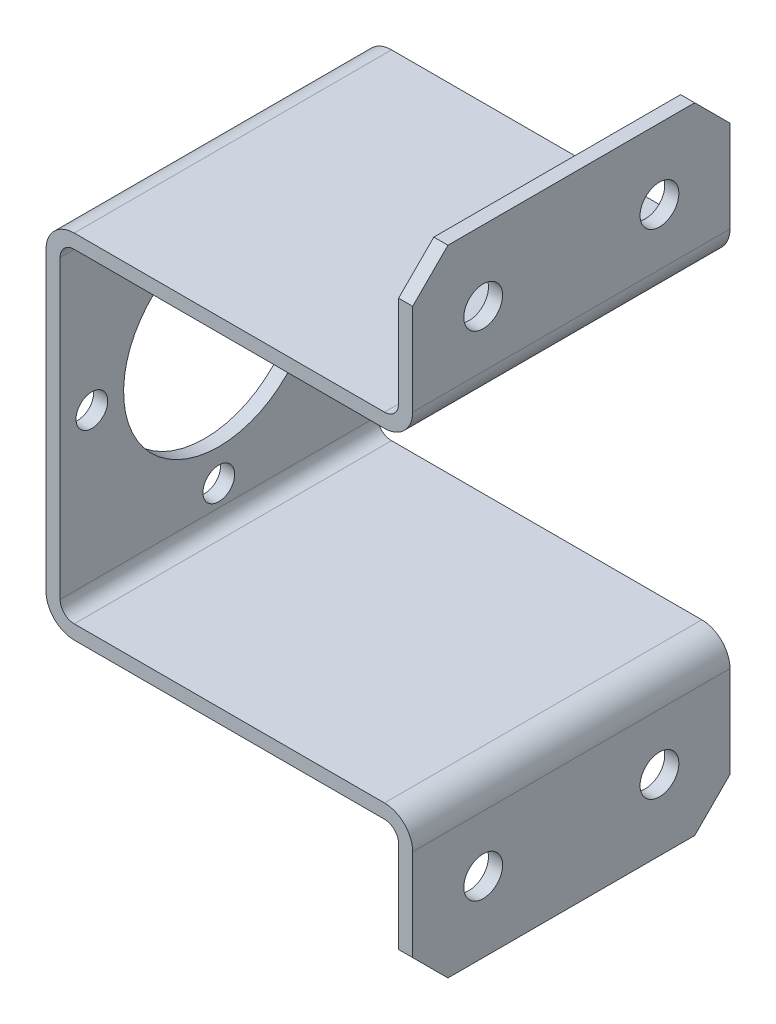
from build123d import *

# Parameters (mm, degrees)
BOSS_EXTRU_1_DEPTH           = 22.5
D_GAGEMENT_M51_D             = 5.5
D_GAGEMENT_M42_D             = 4.5
R_P_TITION_CIRCULAIRE2_COUNT = 4
CONG_1_R                     = 2
CHANFREIN1_SIZE              = 5
CONG_2_R                     = 4
ENL_V_MAT_EXTRU_1_REACH      = 92.057
ESQUISSE16_R                 = 13.5


with BuildPart() as part:
    # Esquisse1 → Boss.-Extru.1 (new, symmetric)
    with BuildSketch(Plane.XY):
        Polygon((52, 70), (50, 70), (50, 50), (0, 50), (0, 0), (50, 0), (50, -20), (52, -20), (52, 2), (2, 2), (2, 48), (52, 48), align=None)
    extrude(amount=BOSS_EXTRU_1_DEPTH, both=True)

    # Dégagement M51 (through all)
    with Locations(Plane.ZY.offset(-50)):
        with Locations((12.5, 60), (-12.5, 60), (-12.5, -10), (12.5, -10)):
            Hole(D_GAGEMENT_M51_D / 2)

    # Dégagement M42 (through all)
    with Locations(Plane.ZY):
        with Locations((0, 7)):
            d_gagement_m42 = Hole(D_GAGEMENT_M42_D / 2)

    # Répétition circulaire2: Dégagement M42 ×4 about axis
    r_p_tition_circulaire2_axis = Axis((0, 25, 0), (1, 0, 0))
    for i in range(1, R_P_TITION_CIRCULAIRE2_COUNT):
        add(d_gagement_m42.rotate(r_p_tition_circulaire2_axis, i * 360 / R_P_TITION_CIRCULAIRE2_COUNT), mode=Mode.SUBTRACT)

    # Congé1
    cong_1_edges = [part.edges().sort_by_distance(p)[0] for p in [
        (2, 48, 0),
        (2, 2, 0),
        (50, 0, 0),
        (50, 50, 0),
    ]]
    fillet(cong_1_edges, radius=CONG_1_R)

    # Chanfrein1
    chanfrein1_edges = [part.edges().sort_by_distance(p)[0] for p in [
        (51, -20, -22.5),
        (51, 70, -22.5),
        (51, -20, 22.5),
        (51, 70, 22.5),
    ]]
    chamfer(chanfrein1_edges, length=CHANFREIN1_SIZE)

    # Congé2
    cong_2_edges = [part.edges().sort_by_distance(p)[0] for p in [
        (52, 48, 0),
        (52, 2, 0),
        (0, 0, 0),
        (0, 50, 0),
    ]]
    fillet(cong_2_edges, radius=CONG_2_R)

    # Esquisse16 → Enlèv. mat.-Extru.1 (cut, up to next)
    with BuildSketch(Plane.ZY, mode=Mode.PRIVATE) as enl_v_mat_extru_1_sk1:
        with Locations(Location((0, 25, 0), (0, 0, 270))):
            Circle(ESQUISSE16_R)
    enl_v_mat_extru_1_tool1 = extrude(enl_v_mat_extru_1_sk1.sketch, amount=-ENL_V_MAT_EXTRU_1_REACH, mode=Mode.PRIVATE) & part.part
    add(enl_v_mat_extru_1_tool1.solids().sort_by_distance((0, 25, 0))[0], mode=Mode.SUBTRACT)


solid = part.part
